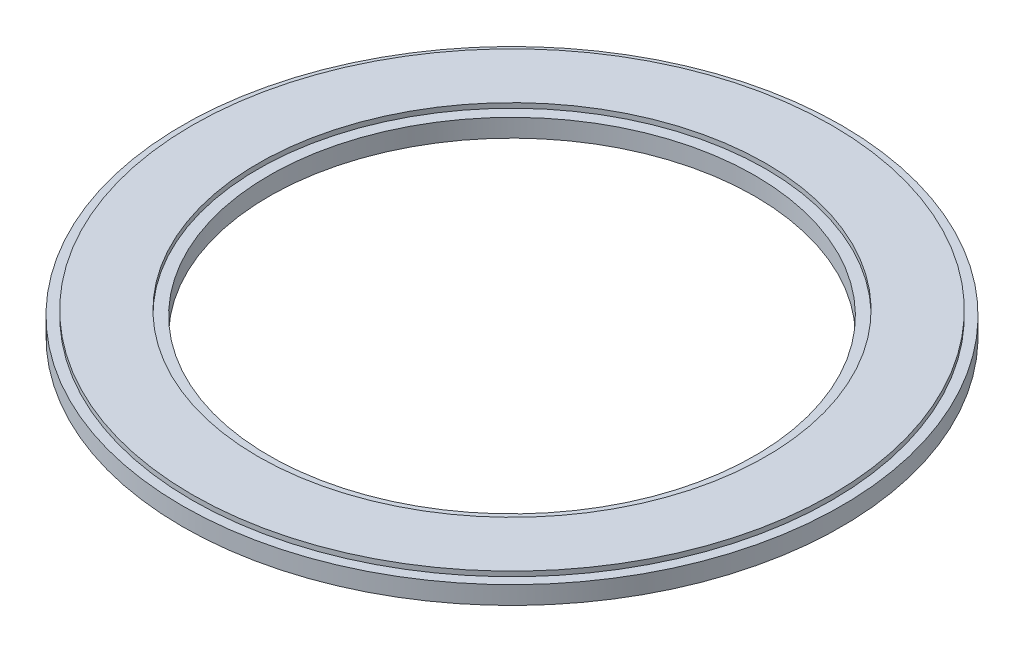
from build123d import *


with BuildPart() as part:
    # Skizze1 → Rotation1 (revolve)
    with BuildSketch(Plane.XY, mode=Mode.PRIVATE) as rotation1_sk:
        Polygon((36.6, 0), (46.1, 0), (46.1, 0.7), (47.5, 0.7), (47.5, 3.3), (46.1, 3.3), (46.1, 4), (36.6, 4), (36.6, 3.3), (35, 3.3), (35, 0.7), (36.6, 0.7), align=None)
    revolve(rotation1_sk.sketch.rotate(Axis((0, 0, 0), (0, 1, 0)), 90), axis=Axis((0, 0, 0), (0, 1, 0)))


solid = part.part
